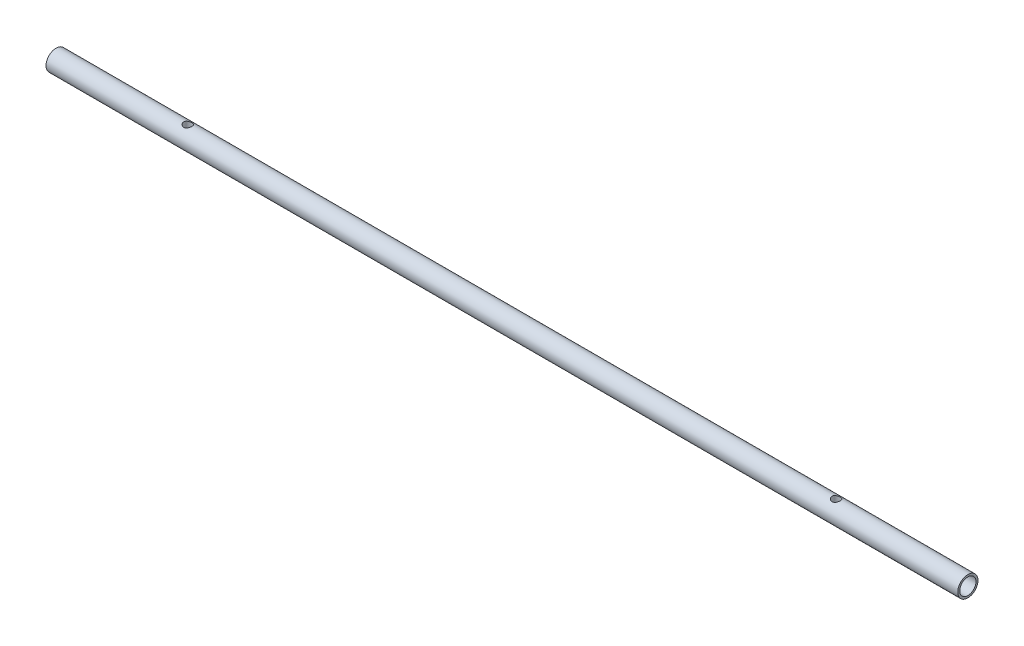
from build123d import *

# Parameters (mm, degrees)
SKETCH1_R               = 10
BOSS_EXTRUDE1_DEPTH     = 900
SKETCH2_R               = 8
CUT_EXTRUDE1_DEPTH      = 40
CUT_EXTRUDE2_START      = -40
SKETCH3_R               = 8
CUT_EXTRUDE2_DEPTH      = 40
CUT_EXTRUDE3_DEPTH      = 40
CUT_EXTRUDE3_DEPTH_BACK = 40
SKETCH4_R               = 4


with BuildPart() as part:
    # Sketch1 → Boss-Extrude1 (new body)
    with BuildSketch(Plane.YZ):
        Circle(SKETCH1_R)
    extrude(amount=BOSS_EXTRUDE1_DEPTH)

    # Sketch2 → Cut-Extrude1 (cut)
    with BuildSketch(Plane.YZ.offset(900)):
        Circle(SKETCH2_R)
    extrude(amount=-CUT_EXTRUDE1_DEPTH, mode=Mode.SUBTRACT)

    # Sketch3 → Cut-Extrude2 (cut)
    with BuildSketch(Plane(origin=(0, 0, 0), x_dir=(0, -1, 0), z_dir=(-1, 0, 0)).offset(CUT_EXTRUDE2_START)):
        Circle(SKETCH3_R)
    extrude(amount=CUT_EXTRUDE2_DEPTH, mode=Mode.SUBTRACT)

    # Sketch4 → Cut-Extrude3 (cut, two sides: drawn at the far end of the back side and taken through both)
    with BuildSketch(Plane(origin=(0, 0, 0), x_dir=(-1, 0, 0), z_dir=(0, 1, 0)).offset(-CUT_EXTRUDE3_DEPTH_BACK)):
        with Locations((-130, 0)):
            Circle(SKETCH4_R)
        with Locations((-770, 0)):
            Circle(SKETCH4_R)
    extrude(amount=CUT_EXTRUDE3_DEPTH + CUT_EXTRUDE3_DEPTH_BACK, mode=Mode.SUBTRACT)


solid = part.part
